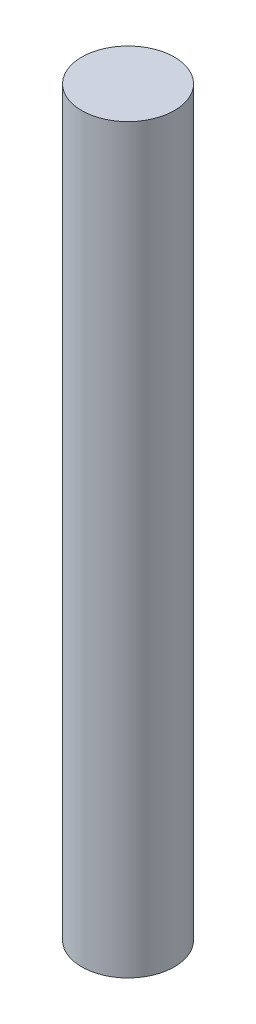
from build123d import *

# Parameters (mm, degrees)
SKETCH2_W = 6.35
SKETCH2_H = 101.6


with BuildPart() as part:
    # Sketch2 → Revolve-Thin1 (revolve)
    with BuildSketch(Plane.XY, mode=Mode.PRIVATE) as revolve_thin1_sk:
        with Locations((-3.175, 50.8)):
            Rectangle(SKETCH2_W, SKETCH2_H)
    revolve(revolve_thin1_sk.sketch.rotate(Axis((0, 0, 0), (0, 1, 0)), 270), axis=Axis((0, 0, 0), (0, 1, 0)))


solid = part.part
